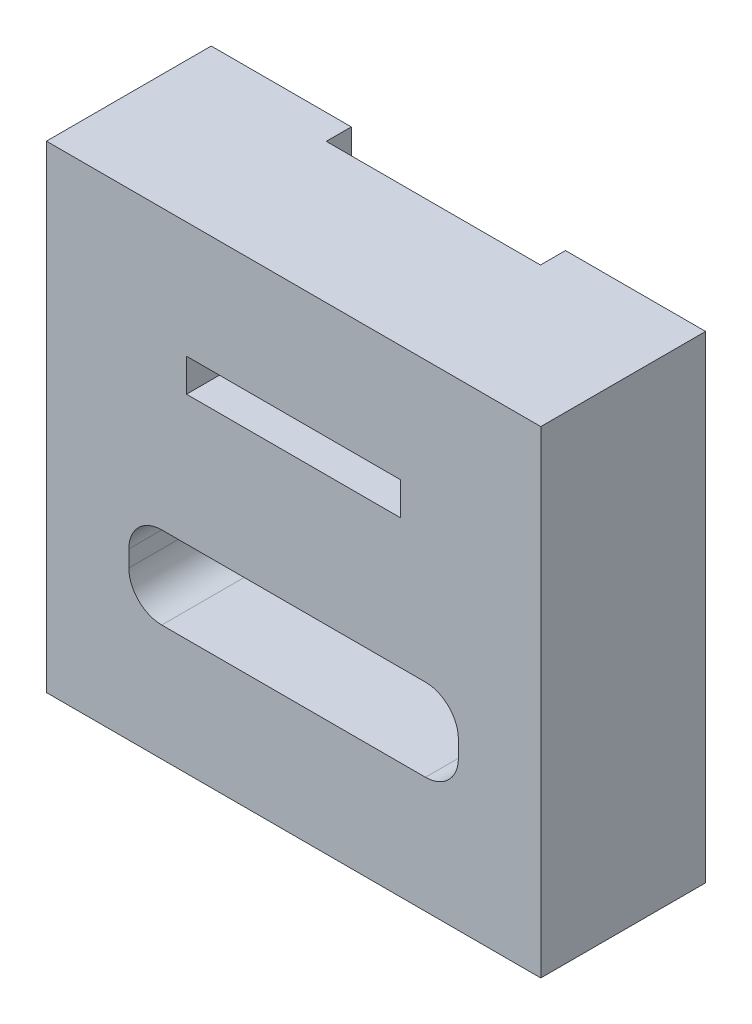
from build123d import *

# Parameters (mm, degrees)
SKETCH1_W           = 30
SKETCH1_H           = 28.98
SKETCH1_W_2         = 13
SKETCH1_H_2         = 2
SKETCH1_W_3         = 20
SKETCH1_H_3         = 5
BOSS_EXTRUDE1_DEPTH = 10
FILLET1_R           = 2
SKETCH2_W           = 13
SKETCH2_H           = 7.05
CUT_EXTRUDE1_DEPTH  = 1.52
FILLET2_R           = 2


with BuildPart() as part:
    # Sketch1 → Boss-Extrude1 (new body)
    with BuildSketch(Plane.XY):
        with Locations((3.3, -86.56)):
            Rectangle(SKETCH1_W, SKETCH1_H)
        with Locations((3.3, -80.12)):
            Rectangle(SKETCH1_W_2, SKETCH1_H_2, mode=Mode.SUBTRACT)
        with Locations((3.3, -91.5)):
            Rectangle(SKETCH1_W_3, SKETCH1_H_3, mode=Mode.SUBTRACT)
    extrude(amount=BOSS_EXTRUDE1_DEPTH)

    # Fillet1
    fillet1_edges = [part.edges().sort_by_distance(p)[0] for p in [
        (-6.7, -89, 5),
        (-6.7, -94, 5),
        (13.3, -94, 5),
        (13.3, -89, 5),
    ]]
    fillet(fillet1_edges, radius=FILLET1_R)

    # Sketch2 → Cut-Extrude1 (cut)
    with BuildSketch(Plane(origin=(0, 0, 0), x_dir=(-1, 0, 0), z_dir=(0, 0, -1))):
        with Locations((-3.3, -75.595)):
            Rectangle(SKETCH2_W, SKETCH2_H)
    extrude(amount=-CUT_EXTRUDE1_DEPTH, mode=Mode.SUBTRACT)

    # Fillet2
    fillet2_edges = [part.edges().sort_by_distance(p)[0] for p in [
        (3.3, -79.12, 1.52),
    ]]
    fillet(fillet2_edges, radius=FILLET2_R)


solid = part.part
